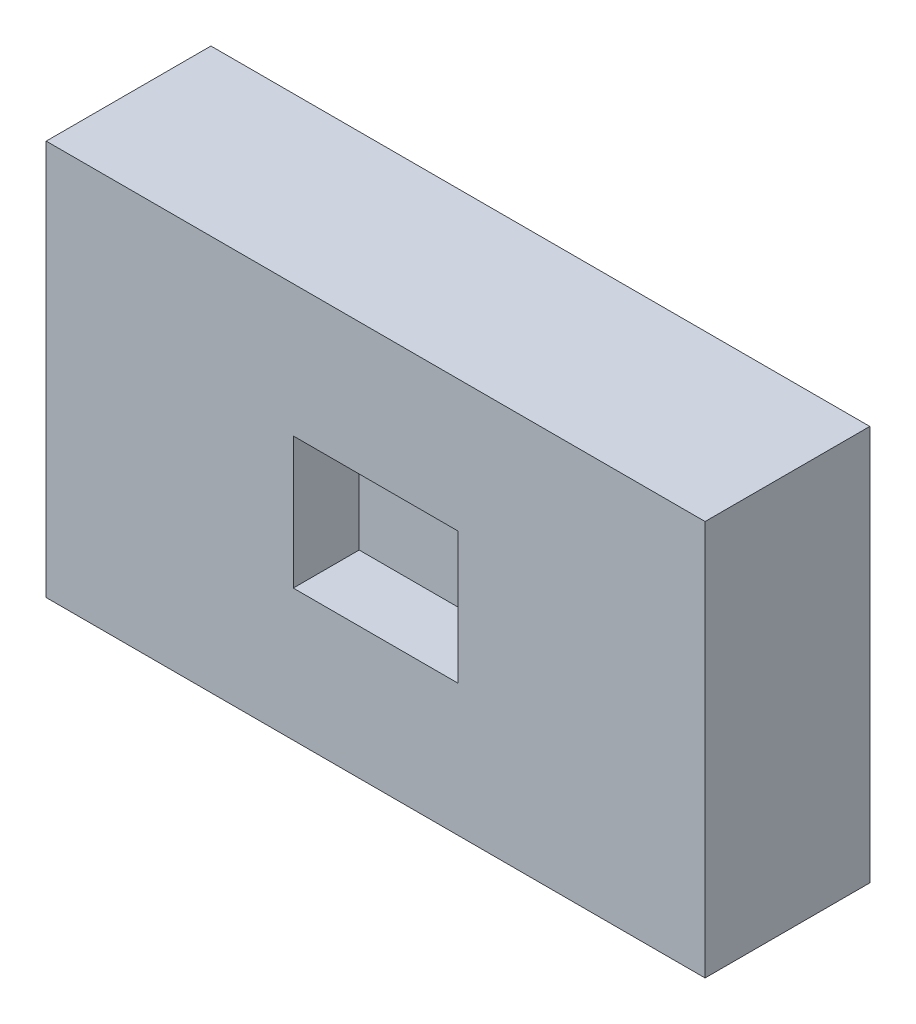
from build123d import *

# Parameters (mm, degrees)
RECTANGLESKETCH_W = 40
RECTANGLESKETCH_H = 24
BLINDBOSS_DEPTH   = 10
CUTSKETCH_W       = 10
CUTSKETCH_H       = 8
BLINDCUT_DEPTH    = 4


with BuildPart() as part:
    # RectangleSketch → BlindBoss (new body)
    with BuildSketch(Plane.XY):
        with Locations((20, 12)):
            Rectangle(RECTANGLESKETCH_W, RECTANGLESKETCH_H)
    extrude(amount=BLINDBOSS_DEPTH)

    # CutSketch → BlindCut (cut)
    with BuildSketch(Plane.XY.offset(10)):
        with Locations((20, 12)):
            Rectangle(CUTSKETCH_W, CUTSKETCH_H)
    extrude(amount=-BLINDCUT_DEPTH, mode=Mode.SUBTRACT)


solid = part.part
